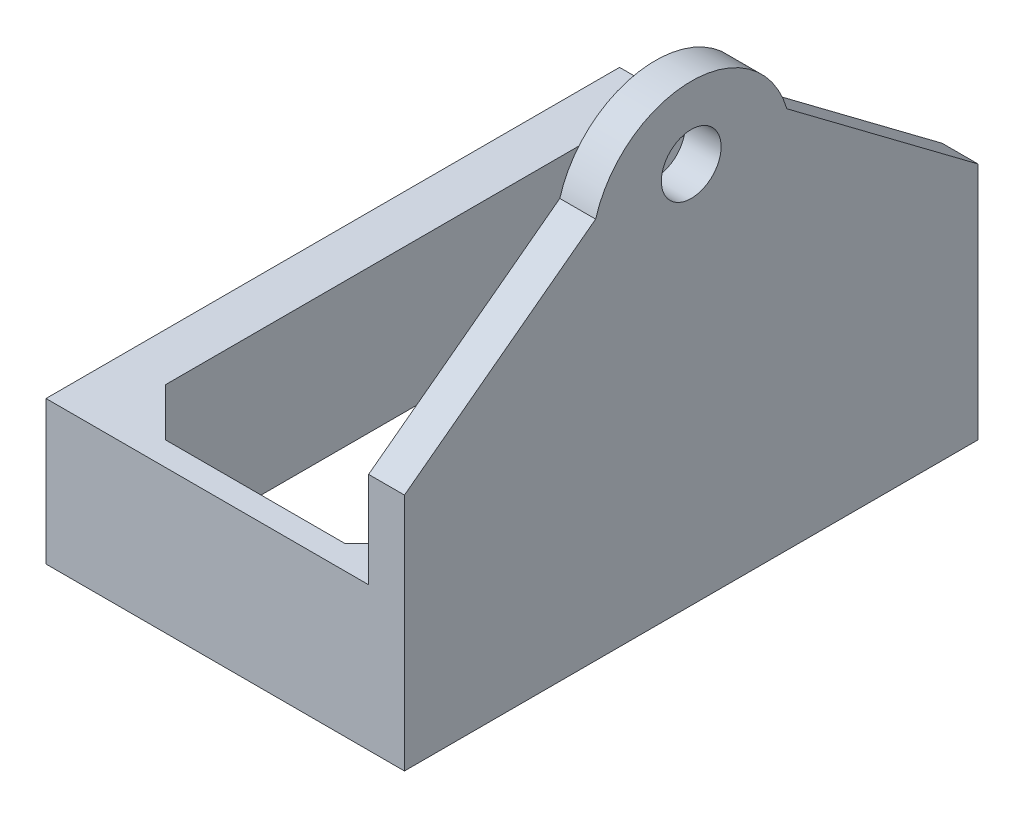
from build123d import *

# Parameters (mm, degrees)
BOSS_EXTRUDE1_DEPTH = 6.35
BOSS_EXTRUDE2_DEPTH = 60.325
SKETCH2_W           = 6.35
SKETCH2_H           = 76.2
BOSS_EXTRUDE3_DEPTH = 12.7
CUT_EXTRUDE2_REACH  = 87.784
CUT_EXTRUDE3_REACH  = 87.784
SKETCH4_3_R         = 3.96875
SKETCH7_W           = 36.5125
SKETCH7_H           = 3.175
BOSS_EXTRUDE5_DEPTH = 12.7
CHAMFER6_SIZE       = 6.35


with BuildPart() as part:
    # Sketch1 → Boss-Extrude1 (new body)
    with BuildSketch(Plane(origin=(0, 0, 0), x_dir=(1, 0, 0), z_dir=(0, 1, 0))):
        Polygon((19.05, 34.925), (19.05, 38.1), (-23.8125, 38.1), (-23.8125, -38.1), (19.05, -38.1), (19.05, -34.925), (-17.4625, -34.925), (-17.4625, 34.925), align=None)
    extrude(amount=BOSS_EXTRUDE1_DEPTH)

    # Sketch1<4> → Boss-Extrude2 (add)
    with BuildSketch(Plane(origin=(0, 0, 0), x_dir=(1, 0, 0), z_dir=(0, 1, 0))):
        Polygon((23.8125, 38.1), (19.05, 38.1), (19.05, 34.925), (19.05, -34.925), (19.05, -38.1), (23.8125, -38.1), align=None)
    extrude(amount=BOSS_EXTRUDE2_DEPTH)

    # Sketch2 → Boss-Extrude3 (add)
    with BuildSketch(Plane(origin=(0, 6.35, 0), x_dir=(1, 0, 0), z_dir=(0, 1, 0))):
        with Locations((-20.6375, 0)):
            Rectangle(SKETCH2_W, SKETCH2_H)
    extrude(amount=BOSS_EXTRUDE3_DEPTH)

    # Sketch4 → Cut-Extrude2 (cut, up to next)
    with BuildSketch(Plane(origin=(23.8125, 0, 0), x_dir=(0, 0, -1), z_dir=(1, 0, 0)), mode=Mode.PRIVATE) as cut_extrude2_sk1:
        with BuildLine():
            Line((-38.1, 60.325), (-38.1, 31.75))
            Line((-38.1, 31.75), (-12.7, 50.8))
            ThreePointArc((-12.7, 50.8), (-7.9375, 57.679166667), (0, 60.325))
            Line((0, 60.325), (-38.1, 60.325))
        make_face()
    cut_extrude2_tool1 = extrude(cut_extrude2_sk1.sketch, amount=-CUT_EXTRUDE2_REACH, mode=Mode.PRIVATE) & part.part
    # Sketch4 → Cut-Extrude2 (cut, up to next)
    with BuildSketch(Plane(origin=(23.8125, 0, 0), x_dir=(0, 0, -1), z_dir=(1, 0, 0)), mode=Mode.PRIVATE) as cut_extrude2_sk2:
        with BuildLine():
            Line((38.1, 60.325), (0, 60.325))
            ThreePointArc((0, 60.325), (7.9375, 57.679166667), (12.7, 50.8))
            Line((12.7, 50.8), (38.1, 31.75))
            Line((38.1, 31.75), (38.1, 60.325))
        make_face()
    cut_extrude2_tool2 = extrude(cut_extrude2_sk2.sketch, amount=-CUT_EXTRUDE2_REACH, mode=Mode.PRIVATE) & part.part
    add(cut_extrude2_tool1.solids().sort_by_distance((23.8125, 50.488362, 26.421388))[0], mode=Mode.SUBTRACT)
    add(cut_extrude2_tool2.solids().sort_by_distance((23.8125, 50.488362, -26.421388))[0], mode=Mode.SUBTRACT)

    # Sketch4<3> → Cut-Extrude3 (cut, up to next)
    with BuildSketch(Plane(origin=(23.8125, 0, 0), x_dir=(0, 0, -1), z_dir=(1, 0, 0)), mode=Mode.PRIVATE) as cut_extrude3_sk1:
        with Locations((0, 50.8)):
            Circle(SKETCH4_3_R)
    cut_extrude3_tool1 = extrude(cut_extrude3_sk1.sketch, amount=-CUT_EXTRUDE3_REACH, mode=Mode.PRIVATE) & part.part
    add(cut_extrude3_tool1.solids().sort_by_distance((23.8125, 50.8, 0))[0], mode=Mode.SUBTRACT)

    # Sketch7 → Boss-Extrude5 (add)
    with BuildSketch(Plane(origin=(0, 6.35, 0), x_dir=(1, 0, 0), z_dir=(0, 1, 0))):
        with Locations((0.79375, 36.5125)):
            Rectangle(SKETCH7_W, SKETCH7_H)
        with Locations((0.79375, -36.5125)):
            Rectangle(SKETCH7_W, SKETCH7_H)
    extrude(amount=BOSS_EXTRUDE5_DEPTH)

    # Chamfer6
    chamfer6_edges = [part.edges().sort_by_distance(p)[0] for p in [
        (19.05, 9.525, -34.925),
        (19.05, 9.525, 34.925),
        (-17.4625, 9.525, 34.925),
        (-17.4625, 9.525, -34.925),
    ]]
    chamfer(chamfer6_edges, length=CHAMFER6_SIZE)


solid = part.part
